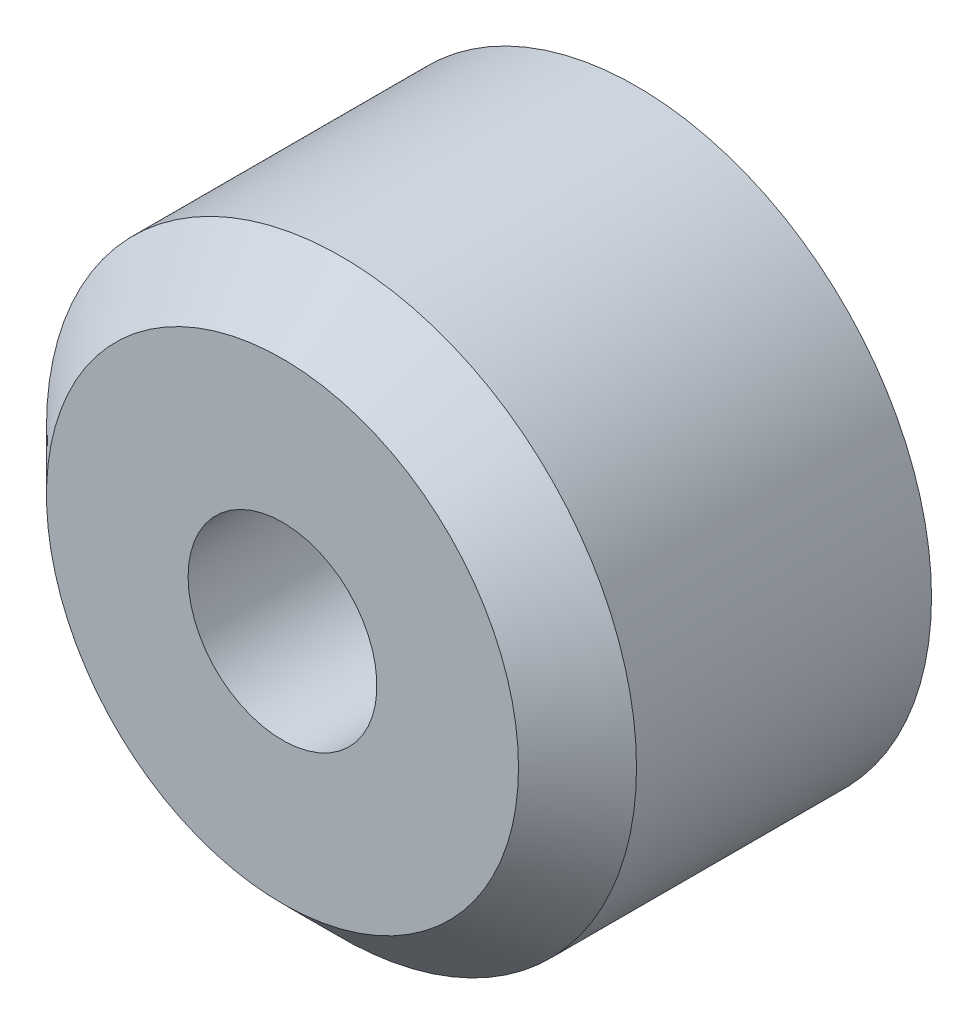
from build123d import *

# Parameters (mm, degrees)
SKETCH1_R                                       = 5
BOSS_EXTRUDE1_DEPTH                             = 6
CSK_FOR_M3_FLAT_HEAD_MACHINE_SCREW1_D           = 3.2
CSK_FOR_M3_FLAT_HEAD_MACHINE_SCREW1_CSINK_D     = 6.3
CSK_FOR_M3_FLAT_HEAD_MACHINE_SCREW1_CSINK_ANGLE = 90
CHAMFER1_SIZE                                   = 1


with BuildPart() as part:
    # Sketch1 → Boss-Extrude1 (new body)
    with BuildSketch(Plane.XY):
        Circle(SKETCH1_R)
    extrude(amount=BOSS_EXTRUDE1_DEPTH)

    # CSK for M3 Flat Head Machine Screw1 (through all)
    with Locations(Plane(origin=(0, 0, 0), x_dir=(-1, 0, 0), z_dir=(0, 0, -1))):
        with Locations((0, 0)):
            CounterSinkHole(CSK_FOR_M3_FLAT_HEAD_MACHINE_SCREW1_D / 2, CSK_FOR_M3_FLAT_HEAD_MACHINE_SCREW1_CSINK_D / 2, counter_sink_angle=CSK_FOR_M3_FLAT_HEAD_MACHINE_SCREW1_CSINK_ANGLE)

    # Chamfer1
    chamfer1_edges = [part.edges().sort_by_distance(p)[0] for p in [
        (-5, 0, 6),
    ]]
    chamfer(chamfer1_edges, length=CHAMFER1_SIZE)


solid = part.part
